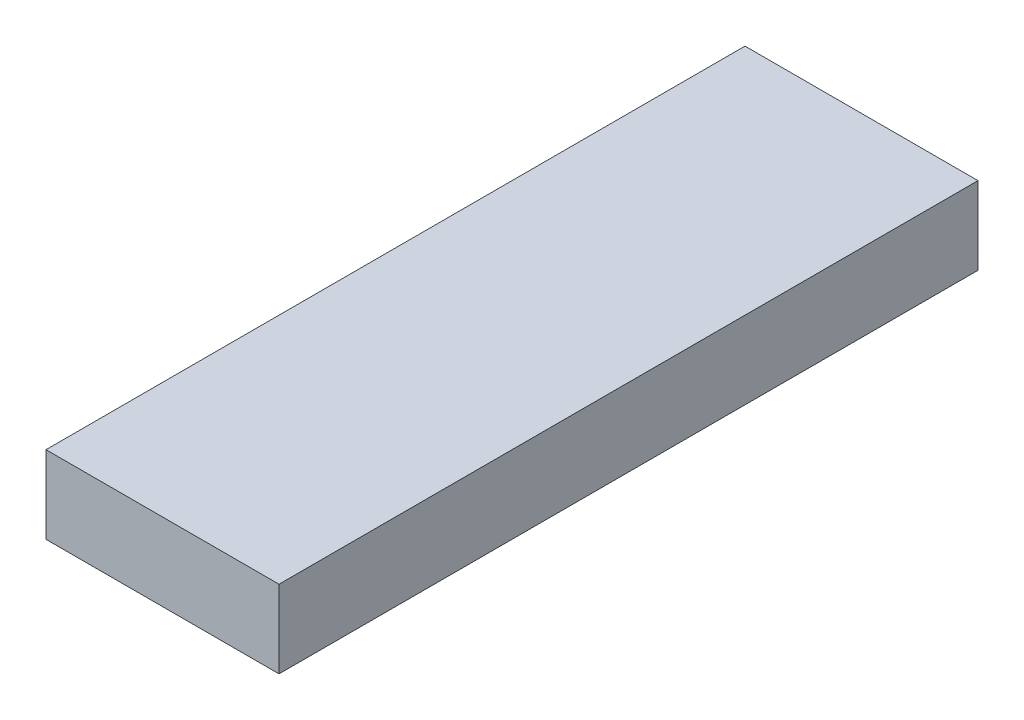
from build123d import *

# Parameters (mm, degrees)
SKETCH1_W           = 3000
SKETCH1_H           = 9000
BOSS_EXTRUDE1_DEPTH = 1000


with BuildPart() as part:
    # Sketch1 → Boss-Extrude1 (new body)
    with BuildSketch(Plane(origin=(0, 0, 0), x_dir=(1, 0, 0), z_dir=(0, 1, 0))):
        Rectangle(SKETCH1_W, SKETCH1_H)
    extrude(amount=BOSS_EXTRUDE1_DEPTH)


solid = part.part
